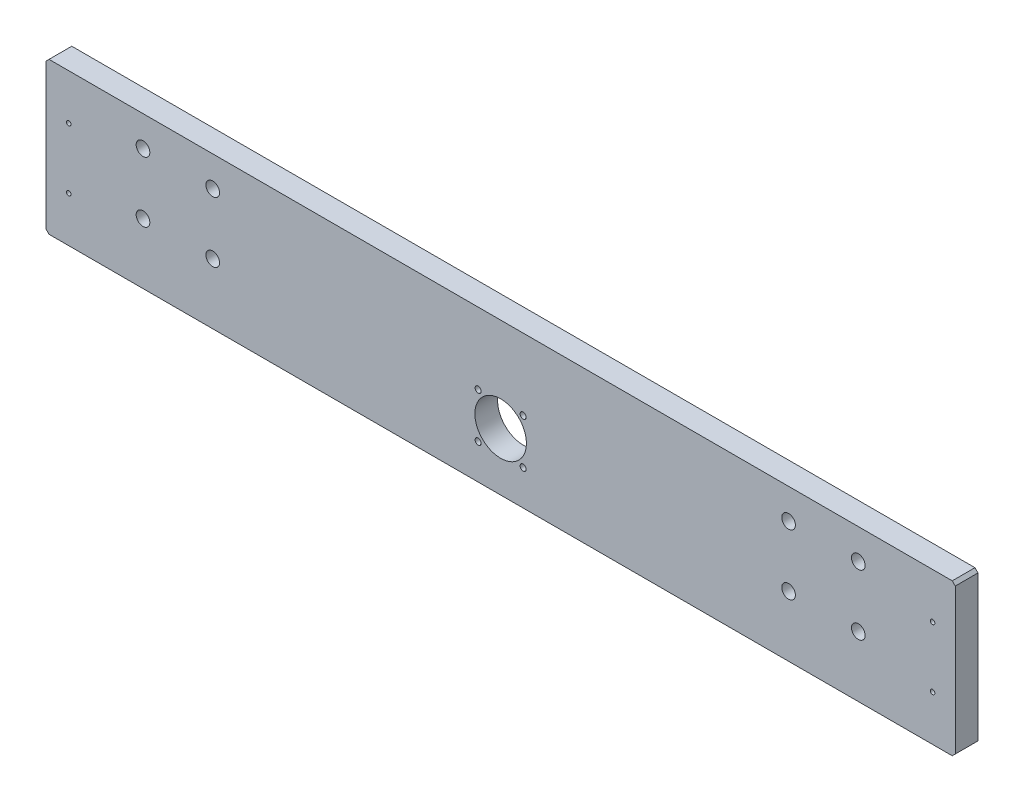
from build123d import *

# Parameters (mm, degrees)
SCHIZZO1_R                   = 17
SCHIZZO1_R_2                 = 2
SCHIZZO1_R_3                 = 4.5
SCHIZZO1_R_4                 = 1.5
ESTRUSIONE_ESTRUSIONE1_DEPTH = 15
M8_TAPPED_HOLE1_D            = 6.8
M8_TAPPED_HOLE1_DEPTH        = 23.75
M8_TAPPED_HOLE1_TIP          = 2.042926105


with BuildPart() as part:
    # Schizzo1 → Estrusione-Estrusione1 (new body)
    with BuildSketch(Plane.XY):
        Polygon((2, 0), (598, 0), (600, 2), (600, 98), (598, 100), (2, 100), (0, 98), (0, 2), align=None)
        with Locations((300, 38)):
            Circle(SCHIZZO1_R, mode=Mode.SUBTRACT)
        with Locations(Location((314.849242405, 52.849242405, 0), (0, 0, 180))):
            Circle(SCHIZZO1_R_2, mode=Mode.SUBTRACT)
        with Locations(Location((110, 40, 0), (0, 0, 180))):
            Circle(SCHIZZO1_R_3, mode=Mode.SUBTRACT)
        with Locations((314.849242405, 23.150757595)):
            Circle(SCHIZZO1_R_2, mode=Mode.SUBTRACT)
        with Locations(Location((285.150757595, 23.150757595, 0), (0, 0, 180))):
            Circle(SCHIZZO1_R_2, mode=Mode.SUBTRACT)
        with Locations(Location((110, 80, 0), (0, 0, 180))):
            Circle(SCHIZZO1_R_3, mode=Mode.SUBTRACT)
        with Locations(Location((536, 40, 0), (0, 0, 180))):
            Circle(SCHIZZO1_R_3, mode=Mode.SUBTRACT)
        with Locations((64, 40)):
            Circle(SCHIZZO1_R_3, mode=Mode.SUBTRACT)
        with Locations((64, 80)):
            Circle(SCHIZZO1_R_3, mode=Mode.SUBTRACT)
        with Locations((490, 40)):
            Circle(SCHIZZO1_R_3, mode=Mode.SUBTRACT)
        with Locations((15, 30)):
            Circle(SCHIZZO1_R_4, mode=Mode.SUBTRACT)
        with Locations(Location((585, 30, 0), (0, 0, 180))):
            Circle(SCHIZZO1_R_4, mode=Mode.SUBTRACT)
        with Locations((285.150757595, 52.849242405)):
            Circle(SCHIZZO1_R_2, mode=Mode.SUBTRACT)
        with Locations((490, 80)):
            Circle(SCHIZZO1_R_3, mode=Mode.SUBTRACT)
        with Locations(Location((536, 80, 0), (0, 0, 180))):
            Circle(SCHIZZO1_R_3, mode=Mode.SUBTRACT)
        with Locations((585, 70)):
            Circle(SCHIZZO1_R_4, mode=Mode.SUBTRACT)
        with Locations(Location((15, 70, 0), (0, 0, 180))):
            Circle(SCHIZZO1_R_4, mode=Mode.SUBTRACT)
    extrude(amount=-ESTRUSIONE_ESTRUSIONE1_DEPTH)

    # M8 Tapped Hole1
    with Locations(Plane(origin=(30, 0, -7.5), x_dir=(0, 0, -1), z_dir=(0, -1, 0))):
        with Locations((0, 0), (0, 540)):
            Hole(M8_TAPPED_HOLE1_D / 2, depth=M8_TAPPED_HOLE1_DEPTH)
            with Locations((0, 0, -(M8_TAPPED_HOLE1_DEPTH + M8_TAPPED_HOLE1_TIP / 2))):  # 118° drill point
                Cone(0, M8_TAPPED_HOLE1_D / 2, M8_TAPPED_HOLE1_TIP, mode=Mode.SUBTRACT)


solid = part.part
